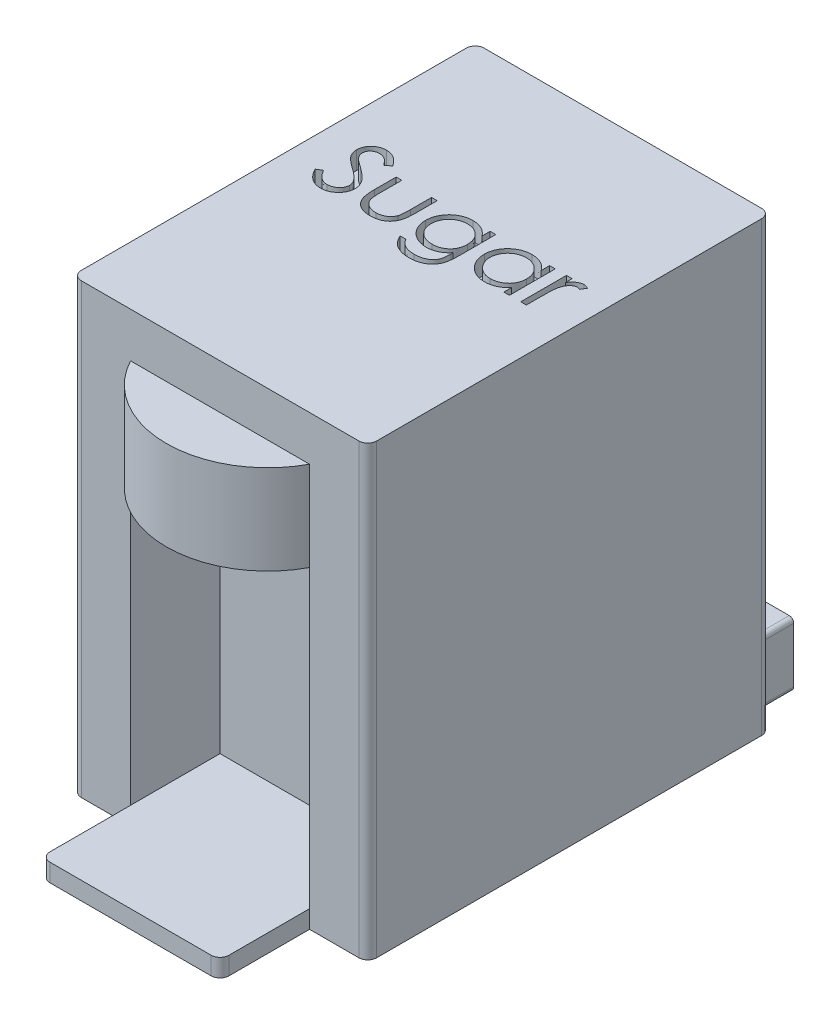
from build123d import *

# Parameters (mm, degrees)
SKETCH1_W           = 330
SKETCH1_H           = 450
BOSS_EXTRUDE1_DEPTH = 500
SKETCH2_W           = 200
SKETCH2_H           = 350
CUT_EXTRUDE1_DEPTH  = 100
BOSS_EXTRUDE2_DEPTH = 100
SKETCH4_W           = 200
SKETCH4_H           = 20
BOSS_EXTRUDE3_DEPTH = 200
SKETCH5_R           = 58.984993577
CUT_EXTRUDE2_DEPTH  = 50
FILLET1_R           = 10
SKETCH6_W           = 108.793875533
SKETCH6_H           = 71.48855694
BOSS_EXTRUDE4_DEPTH = 50
FILLET2_R           = 5
FILLET3_R           = 10
CUT_EXTRUDE3_DEPTH  = 20


with BuildPart() as part:
    # Sketch1 → Boss-Extrude1 (new body)
    with BuildSketch(Plane(origin=(0, 0, 0), x_dir=(1, 0, 0), z_dir=(0, 1, 0))):
        Rectangle(SKETCH1_W, SKETCH1_H)
    extrude(amount=BOSS_EXTRUDE1_DEPTH)

    # Sketch2 → Cut-Extrude1 (cut)
    with BuildSketch(Plane.XY.offset(225)):
        with Locations((0, 175)):
            Rectangle(SKETCH2_W, SKETCH2_H)
    extrude(amount=-CUT_EXTRUDE1_DEPTH, mode=Mode.SUBTRACT)

    # Sketch3 → Boss-Extrude2 (add)
    with BuildSketch(Plane.XZ.offset(-350)):
        with BuildLine():
            Line((100, 225), (-100, 225))
            ThreePointArc((-100, 225), (0, 284.9775435), (100, 225))
        make_face()
    extrude(amount=-BOSS_EXTRUDE2_DEPTH)

    # Sketch4 → Boss-Extrude3 (add)
    with BuildSketch(Plane.XY.offset(125)):
        with Locations((0, 10)):
            Rectangle(SKETCH4_W, SKETCH4_H)
    extrude(amount=BOSS_EXTRUDE3_DEPTH)

    # Sketch5 → Cut-Extrude2 (cut)
    with BuildSketch(Plane.XZ.offset(-350)):
        with Locations((0, 203.171289973)):
            Circle(SKETCH5_R)
    extrude(amount=-CUT_EXTRUDE2_DEPTH, mode=Mode.SUBTRACT)

    # Fillet1
    fillet1_edges = [part.edges().sort_by_distance(p)[0] for p in [
        (165, 250, 225),
        (-165, 250, 225),
        (-165, 250, -225),
        (165, 250, -225),
    ]]
    fillet(fillet1_edges, radius=FILLET1_R)

    # Sketch6 → Boss-Extrude4 (add)
    with BuildSketch(Plane(origin=(0, 0, -225), x_dir=(-1, 0, 0), z_dir=(0, 0, -1))):
        with Locations((-86.447180312, 35.74427847)):
            Rectangle(SKETCH6_W, SKETCH6_H)
    extrude(amount=BOSS_EXTRUDE4_DEPTH)

    # Fillet2
    fillet2_edges = [part.edges().sort_by_distance(p)[0] for p in [
        (140.844118078, 71.48855694, -250),
        (140.844118078, 0, -250),
        (32.050242545, 0, -250),
        (32.050242545, 71.48855694, -250),
    ]]
    fillet(fillet2_edges, radius=FILLET2_R)

    # Fillet3
    fillet3_edges = [part.edges().sort_by_distance(p)[0] for p in [
        (-100, 10, 325),
        (100, 10, 325),
    ]]
    fillet(fillet3_edges, radius=FILLET3_R)

    # Sketch7 → Cut-Extrude3 (cut)
    # profile 1 of 5: a face of its own
    with BuildSketch(Plane(origin=(0, 500, 0), x_dir=(1, 0, 0), z_dir=(0, 1, 0))):
        with BuildLine():
            Line((-132.371794872, 13.503605769), (-126.454326923, 17.051282051))
            add(Edge.make_bspline(
                [(-126.454326923, 17.051282051), (-125.903962178, 16.129994352), (-124.849484566, 14.364842674), (-123.090457382, 11.979681866), (-121.267799159, 9.95243873), (-119.368012488, 8.29490658), (-117.402693526, 6.989928845), (-115.359012451, 6.06588421), (-113.243856237, 5.489564703), (-111.804379807, 5.419562972), (-111.085737179, 5.384615385)],
                knots=[0, 0, 0, 0, 1.272034388, 2.437168799, 3.508375237, 4.49857839, 5.41946034, 6.295179144, 7.148887113, 8, 8, 8, 8], degree=3))
            add(Edge.make_bspline(
                [(-111.085737179, 5.384615385), (-110.471999969, 5.401708835), (-109.255264508, 5.43559664), (-107.464019649, 5.761212681), (-105.724383604, 6.261455259), (-104.072210849, 6.97787389), (-102.530298559, 7.844643604), (-101.178164652, 8.891567154), (-100.009242388, 10.063691268), (-99.053060097, 11.371344361), (-98.319459391, 12.777687333), (-97.755618023, 14.22120636), (-97.44271655, 15.724577726), (-97.395581481, 16.736786983), (-97.371794872, 17.247596154)],
                knots=[0, 0, 0, 0, 1.095163259, 2.171163733, 3.241058638, 4.321873601, 5.38011039, 6.391990106, 7.366004449, 8.327778327, 9.272591725, 10.192022065, 11.087607919, 12, 12, 12, 12], degree=3))
            add(Edge.make_bspline(
                [(-97.371794872, 17.247596154), (-97.401281086, 17.830413148), (-97.46122225, 19.015194931), (-97.967851851, 20.76318799), (-98.764836788, 22.493039391), (-99.500089662, 23.563064702), (-99.881810897, 24.118589744)],
                knots=[0, 0, 0, 0, 0.938893495, 1.908633276, 2.914225137, 4, 4, 4, 4], degree=3))
            add(Edge.make_bspline(
                [(-99.881810897, 24.118589744), (-100.195223181, 24.519526216), (-100.853193067, 25.361242187), (-101.984343319, 26.614146897), (-103.311665605, 27.906515276), (-104.789736703, 29.287696415), (-106.47239848, 30.693452348), (-108.306948768, 32.190817907), (-110.340225947, 33.722849448), (-111.76621588, 34.750300759), (-112.502003205, 35.280448718)],
                knots=[0, 0, 0, 0, 0.722233717, 1.516239348, 2.393582979, 3.351407094, 4.387010283, 5.505090956, 6.712668013, 8, 8, 8, 8], degree=3))
            add(Edge.make_bspline(
                [(-112.502003205, 35.280448718), (-113.238483129, 35.80502047), (-114.64657666, 36.807961715), (-116.615748307, 38.296447396), (-118.376637567, 39.657324786), (-119.921417898, 40.903405028), (-121.249409835, 42.034857123), (-122.371078055, 43.040815906), (-123.257849197, 43.948487123), (-123.75096081, 44.537313958), (-123.972355769, 44.801682692)],
                knots=[0, 0, 0, 0, 1.452282411, 2.77665338, 3.964542531, 5.026858415, 5.96415736, 6.766646006, 7.446254459, 8, 8, 8, 8], degree=3))
            add(Edge.make_bspline(
                [(-123.972355769, 44.801682692), (-124.281806674, 45.213703429), (-124.890383408, 46.023997505), (-125.693703517, 47.29049466), (-126.376486773, 48.586959968), (-126.911733416, 49.91687726), (-127.362457793, 51.261575837), (-127.665616407, 52.638600751), (-127.855444346, 54.041773121), (-127.874884076, 54.986043133), (-127.884615385, 55.458733974)],
                knots=[0, 0, 0, 0, 1.068054152, 2.10047183, 3.106115577, 4.101338837, 5.06977816, 6.043150881, 7.020423561, 8, 8, 8, 8], degree=3))
            add(Edge.make_bspline(
                [(-127.884615385, 55.458733974), (-127.858511205, 56.199329466), (-127.806860804, 57.66469074), (-127.370050458, 59.805307349), (-126.680592585, 61.849035694), (-125.714694828, 63.775642368), (-124.469547769, 65.534961986), (-123.028628282, 67.147231725), (-121.312398557, 68.50260337), (-119.429346092, 69.686844538), (-117.36821865, 70.613763042), (-115.208400582, 71.312982645), (-112.946459142, 71.709167799), (-111.41439645, 71.766023097), (-110.637019231, 71.794871795)],
                knots=[0, 0, 0, 0, 1.005424448, 1.989358655, 2.955360095, 3.929531133, 4.905563448, 5.876582895, 6.856512386, 7.866279853, 8.892233794, 9.918561126, 10.94386622, 12, 12, 12, 12], degree=3))
            add(Edge.make_bspline(
                [(-110.637019231, 71.794871795), (-109.812137225, 71.766420763), (-108.17171019, 71.709840741), (-105.758725878, 71.217890115), (-103.43551155, 70.403876679), (-101.566646254, 69.480103519), (-100.103991025, 68.557475205), (-98.988536371, 67.717078719), (-97.858187355, 66.749576547), (-96.703826259, 65.652391626), (-95.54501307, 64.415456604), (-94.364544025, 63.047242826), (-93.159658649, 61.556111708), (-92.384541446, 60.491621693), (-91.987179487, 59.945913462)],
                knots=[0, 0, 0, 0, 1.286793592, 2.559021753, 3.825965368, 5.121522368, 5.803751409, 6.523245864, 7.299691795, 8.125521123, 9.008227632, 9.944561021, 10.946284179, 12, 12, 12, 12], degree=3))
            Line((-91.987179487, 59.945913462), (-97.666266026, 55.641025641))
            add(Edge.make_bspline(
                [(-97.666266026, 55.641025641), (-98.009184675, 56.082799449), (-98.669565817, 56.933552514), (-99.672155554, 58.124978826), (-100.617128512, 59.213308417), (-101.548136508, 60.158610977), (-102.416009137, 61.012653644), (-103.258349982, 61.743848781), (-104.063037007, 62.359360689), (-105.07737522, 63.016231888), (-106.351729586, 63.667361959), (-107.951420311, 64.218343521), (-109.623145812, 64.549444759), (-110.761738442, 64.593222511), (-111.338141026, 64.615384615)],
                knots=[0, 0, 0, 0, 1.181633172, 2.275549214, 3.290209073, 4.226197932, 5.078386478, 5.862611352, 6.581680152, 7.217281963, 8.414376989, 9.595101626, 10.782541182, 12, 12, 12, 12], degree=3))
            add(Edge.make_bspline(
                [(-111.338141026, 64.615384615), (-112.061271474, 64.591150616), (-113.455760422, 64.544417632), (-115.435565144, 64.034017926), (-117.217443645, 63.23038072), (-118.748494947, 62.104081158), (-120.023234487, 60.769661305), (-120.945343663, 59.234084203), (-121.500346954, 57.538436151), (-121.568072547, 56.355603024), (-121.602564103, 55.753205128)],
                knots=[0, 0, 0, 0, 1.14458467, 2.207223713, 3.21896685, 4.227309161, 5.202851033, 6.127160689, 7.046193047, 8, 8, 8, 8], degree=3))
            add(Edge.make_bspline(
                [(-121.602564103, 55.753205128), (-121.59470157, 55.378175557), (-121.578963648, 54.627503169), (-121.359467694, 53.51847473), (-121.077481115, 52.412247941), (-120.63062848, 51.313796285), (-120.013722407, 50.203909103), (-119.203618889, 49.063474352), (-118.183352648, 47.882440179), (-117.401812401, 47.114292703), (-116.989182692, 46.708733974)],
                knots=[0, 0, 0, 0, 0.858281714, 1.717966888, 2.583508476, 3.4729293, 4.427298488, 5.488583878, 6.674047936, 8, 8, 8, 8], degree=3))
            add(Edge.make_bspline(
                [(-116.989182692, 46.708733974), (-116.835955244, 46.571993458), (-116.471921901, 46.247129291), (-115.806403387, 45.715283679), (-114.927547422, 45.059228233), (-113.858303398, 44.247481903), (-112.578956164, 43.305852661), (-111.089365041, 42.246380418), (-109.406134384, 41.034671237), (-108.211696066, 40.187520425), (-107.580128205, 39.739583333)],
                knots=[0, 0, 0, 0, 0.420754252, 0.999615792, 1.744751191, 2.668019286, 3.750313428, 4.999500688, 6.413464383, 8, 8, 8, 8], degree=3))
            add(Edge.make_bspline(
                [(-107.580128205, 39.739583333), (-106.820409939, 39.186756142), (-105.349320811, 38.116282907), (-103.256169213, 36.507969307), (-101.358293051, 34.935013935), (-99.64902898, 33.407461793), (-98.111490811, 31.936899933), (-96.762736398, 30.505636327), (-95.589022791, 29.123924873), (-94.325438421, 27.352473359), (-93.034282031, 25.176851674), (-91.925451883, 22.511286903), (-91.226284933, 19.835360493), (-91.134854625, 18.036823763), (-91.08974359, 17.149439103)],
                knots=[0, 0, 0, 0, 1.163667725, 2.253281268, 3.268753668, 4.215851969, 5.092017293, 5.902905408, 6.650798638, 7.335211899, 8.59617414, 9.77448103, 10.901945474, 12, 12, 12, 12], degree=3))
            add(Edge.make_bspline(
                [(-91.08974359, 17.149439103), (-91.102886352, 16.521871801), (-91.128916654, 15.27892413), (-91.428134929, 13.453822592), (-91.866528232, 11.681205198), (-92.527272911, 9.98298295), (-93.333736077, 8.328087696), (-94.357061034, 6.759929688), (-95.543214729, 5.243801716), (-96.903890027, 3.820131889), (-98.392808073, 2.513207969), (-99.966481966, 1.35062674), (-101.627487425, 0.381260272), (-103.366813759, -0.409756569), (-105.184860493, -1.02842692), (-107.08101617, -1.476684302), (-109.058406394, -1.751798521), (-110.402416025, -1.78035375), (-111.085737179, -1.794871795)],
                knots=[0, 0, 0, 0, 0.983748083, 1.948392443, 2.894712957, 3.844097841, 4.80183111, 5.778335162, 6.776009319, 7.81870978, 8.863265674, 9.881300176, 10.883814829, 11.87499822, 12.874611388, 13.892143829, 14.928324115, 16, 16, 16, 16], degree=3))
            add(Edge.make_bspline(
                [(-111.085737179, -1.794871795), (-111.614444039, -1.784648163), (-112.66519924, -1.764329655), (-114.219388878, -1.584704047), (-115.742180662, -1.330561975), (-117.214466302, -0.927080575), (-118.655214535, -0.437541034), (-120.058159226, 0.165225617), (-121.423980303, 0.887569646), (-122.76033196, 1.713470139), (-124.063815452, 2.67462503), (-125.32220481, 3.794094959), (-126.576788521, 5.041005059), (-127.790536447, 6.449216326), (-128.987999333, 7.995977983), (-130.145567524, 9.695761651), (-131.287201878, 11.539308726), (-132.003511234, 12.836610441), (-132.371794872, 13.503605769)],
                knots=[0, 0, 0, 0, 0.915332311, 1.819136955, 2.706846663, 3.586547465, 4.459518054, 5.340707479, 6.227863349, 7.133153174, 8.059268498, 9.028702269, 10.047606654, 11.120612155, 12.245963614, 13.433783089, 14.680604001, 16, 16, 16, 16], degree=3))
        make_face()
    # profile 2 of 5: a face of its own
    with BuildSketch(Plane(origin=(0, 500, 0), x_dir=(1, 0, 0), z_dir=(0, 1, 0))):
        with BuildLine():
            Line((-79.423076923, 51.153846154), (-73.141025641, 51.153846154))
            Line((-73.141025641, 51.153846154), (-73.141025641, 27.427884615))
            add(Edge.make_bspline(
                [(-73.141025641, 27.427884615), (-73.138187543, 26.731429632), (-73.132758394, 25.399143871), (-73.095939576, 23.482040136), (-73.009337703, 21.733705883), (-72.901061213, 20.153131148), (-72.761818491, 18.740583316), (-72.596151281, 17.500996175), (-72.410982848, 16.420312494), (-72.229728569, 15.76944538), (-72.145432692, 15.466746795)],
                knots=[0, 0, 0, 0, 1.388932606, 2.656963016, 3.823490214, 4.879454478, 5.816252168, 6.653371382, 7.373723809, 8, 8, 8, 8], degree=3))
            add(Edge.make_bspline(
                [(-72.145432692, 15.466746795), (-72.010203592, 15.086289375), (-71.742556772, 14.333284154), (-71.257087097, 13.24550405), (-70.656520365, 12.237998401), (-69.999323808, 11.271916947), (-69.241335655, 10.375877209), (-68.392146233, 9.551392336), (-67.480181493, 8.767310511), (-66.125081025, 7.839614672), (-64.271895706, 6.845308069), (-61.838840599, 5.987391701), (-59.200756081, 5.474675301), (-57.377461695, 5.415190201), (-56.440304487, 5.384615385)],
                knots=[0, 0, 0, 0, 0.725840625, 1.436591201, 2.137033971, 2.831655856, 3.53531722, 4.242432219, 4.957935707, 5.694543706, 7.190802206, 8.724350549, 10.316345118, 12, 12, 12, 12], degree=3))
            add(Edge.make_bspline(
                [(-56.440304487, 5.384615385), (-55.503234333, 5.415840357), (-53.690176967, 5.4762549), (-51.081077581, 5.971925672), (-48.696049293, 6.800039452), (-46.559030267, 7.956187688), (-44.679713463, 9.371028945), (-43.113625088, 11.031205119), (-41.821479997, 12.884192857), (-41.257291584, 14.266678433), (-40.973557692, 14.961939103)],
                knots=[0, 0, 0, 0, 1.157059328, 2.238695713, 3.266970494, 4.264342957, 5.228770407, 6.160125903, 7.074715775, 8, 8, 8, 8], degree=3))
            add(Edge.make_bspline(
                [(-40.973557692, 14.961939103), (-40.889673091, 15.241265076), (-40.704224724, 15.858786584), (-40.504977694, 16.906381552), (-40.325488462, 18.155673643), (-40.172224939, 19.614837816), (-40.062921687, 21.280060865), (-40.004001155, 23.150822388), (-39.937435651, 25.221249592), (-39.936425325, 26.670604778), (-39.935897436, 27.427884615)],
                knots=[0, 0, 0, 0, 0.557542046, 1.232589297, 2.036731608, 2.971723315, 4.038036528, 5.22795436, 6.551621927, 8, 8, 8, 8], degree=3))
            Line((-39.935897436, 27.427884615), (-39.935897436, 51.153846154))
            Line((-39.935897436, 51.153846154), (-33.653846154, 51.153846154))
            Line((-33.653846154, 51.153846154), (-33.653846154, 26.25))
            add(Edge.make_bspline(
                [(-33.653846154, 26.25), (-33.66268005, 25.403856571), (-33.679819018, 23.762222574), (-33.789965887, 21.376540343), (-33.97895814, 19.153295446), (-34.26581184, 17.091311048), (-34.603125332, 15.192161414), (-35.038250791, 13.453412494), (-35.557815546, 11.880421415), (-36.143925846, 10.445585877), (-36.836363196, 9.144647993), (-37.572903607, 7.909931661), (-38.423399044, 6.772072957), (-39.318803729, 5.674430213), (-40.314836846, 4.671599665), (-41.392834025, 3.740570148), (-42.537622422, 2.867109513), (-43.774606382, 2.085283925), (-45.085727641, 1.380951018), (-46.472604781, 0.756629456), (-47.952224745, 0.262577915), (-49.505497485, -0.1636354), (-51.140033071, -0.497924783), (-52.854255733, -0.733656118), (-54.647588058, -0.878162736), (-55.869777252, -0.890903633), (-56.496394231, -0.897435897)],
                knots=[0, 0, 0, 0, 1.493040784, 2.896703357, 4.213163133, 5.428574705, 6.569057535, 7.615249723, 8.588095153, 9.490268104, 10.346124644, 11.18633936, 12.024365274, 12.850166724, 13.684164916, 14.514361689, 15.362232829, 16.222528818, 17.093394965, 17.986930858, 18.902426812, 19.842810585, 20.827885679, 21.843828298, 22.894529745, 24, 24, 24, 24], degree=3))
            add(Edge.make_bspline(
                [(-56.496394231, -0.897435897), (-57.118324513, -0.890641755), (-58.340475414, -0.877290631), (-60.133900299, -0.734454477), (-61.852872425, -0.498291064), (-63.491280396, -0.161186717), (-65.050768342, 0.259594682), (-66.537653139, 0.759665392), (-67.934524399, 1.381275027), (-69.258164479, 2.080826176), (-70.498212244, 2.872131684), (-71.660383805, 3.739492477), (-72.743120856, 4.681613738), (-73.746662216, 5.694560881), (-74.656921748, 6.790899608), (-75.485242582, 7.961810814), (-76.244376685, 9.195692586), (-76.931432492, 10.516955835), (-77.521667603, 11.968396031), (-78.042772521, 13.574337972), (-78.468985289, 15.352388309), (-78.815834656, 17.301026878), (-79.094863468, 19.41092771), (-79.288586312, 21.694296016), (-79.396902927, 24.145569859), (-79.414164156, 25.838567659), (-79.423076923, 26.712740385)],
                knots=[0, 0, 0, 0, 1.083640291, 2.129454052, 3.13281866, 4.105697902, 5.042300162, 5.946461698, 6.836384745, 7.703652036, 8.553297018, 9.397182691, 10.228592656, 11.052265423, 11.879314572, 12.708807002, 13.549817954, 14.402308542, 15.300838682, 16.27712199, 17.341985831, 18.484375296, 19.725102775, 21.0496083, 22.476576903, 24, 24, 24, 24], degree=3))
            Line((-79.423076923, 26.712740385), (-79.423076923, 51.153846154))
        make_face()
    # profile 3 of 5: a face of its own
    with BuildSketch(Plane(origin=(0, 500, 0), x_dir=(1, 0, 0), z_dir=(0, 1, 0))):
        with BuildLine():
            Line((25.576923077, 51.153846154), (31.858974359, 51.153846154))
            Line((31.858974359, 51.153846154), (31.858974359, 10.558894231))
            add(Edge.make_bspline(
                [(31.858974359, 10.558894231), (31.853433508, 9.694142339), (31.84273833, 8.024962885), (31.765718905, 5.611397292), (31.60330536, 3.382075582), (31.419131733, 1.32683041), (31.154197407, -0.544811791), (30.830670062, -2.238435885), (30.465956479, -3.755667132), (30.14555213, -4.690163953), (29.993990385, -5.132211538)],
                knots=[0, 0, 0, 0, 1.307562039, 2.523909702, 3.650326591, 4.686913197, 5.643429486, 6.506965704, 7.293745905, 8, 8, 8, 8], degree=3))
            add(Edge.make_bspline(
                [(29.993990385, -5.132211538), (29.77020561, -5.70680997), (29.329327081, -6.838826711), (28.503614412, -8.443513127), (27.578936339, -9.954440924), (26.522801327, -11.36318995), (25.339985246, -12.662688197), (24.058355403, -13.881168183), (22.652951575, -14.99285153), (21.12457733, -15.97855748), (19.508464666, -16.866298563), (17.805542625, -17.635229906), (16.025413858, -18.304966779), (14.151356026, -18.806622693), (12.212751337, -19.241317105), (10.186802715, -19.524210821), (8.085346779, -19.716751983), (6.656439177, -19.734556643), (5.931490385, -19.743589744)],
                knots=[0, 0, 0, 0, 0.981931301, 1.934503488, 2.87077864, 3.801706999, 4.735015492, 5.667491629, 6.616593066, 7.585388521, 8.561939025, 9.551802639, 10.560317337, 11.588439944, 12.640189604, 13.723962949, 14.845264515, 16, 16, 16, 16], degree=3))
            add(Edge.make_bspline(
                [(5.931490385, -19.743589744), (4.873795693, -19.726460027), (2.807833788, -19.693001089), (-0.204266066, -19.303182788), (-3.064960464, -18.752095326), (-5.736449598, -17.917986773), (-8.201851536, -16.897246979), (-10.444329046, -15.72534792), (-12.443751197, -14.381561744), (-14.246224657, -12.851549725), (-15.873056459, -11.032276093), (-17.403602259, -8.88829921), (-18.876821096, -6.386961427), (-19.740193854, -4.551107163), (-20.192307692, -3.58974359)],
                knots=[0, 0, 0, 0, 1.157897085, 2.2616841, 3.32207898, 4.345638746, 5.321241055, 6.241986252, 7.112515963, 7.955008012, 8.825025602, 9.77857164, 10.836726669, 12, 12, 12, 12], degree=3))
            Line((-20.192307692, -3.58974359), (-13.91025641, -3.58974359))
            add(Edge.make_bspline(
                [(-13.91025641, -3.58974359), (-13.405012224, -4.391861105), (-12.417322056, -5.959902075), (-10.570352437, -7.990165194), (-8.54622591, -9.725232488), (-6.276632246, -11.123447969), (-3.752127938, -12.177643797), (-0.971194215, -12.929149726), (2.08879822, -13.379075063), (4.219162504, -13.433300946), (5.328525641, -13.461538462)],
                knots=[0, 0, 0, 0, 0.997731894, 1.950442991, 2.880492273, 3.800895997, 4.748200782, 5.754801363, 6.83083817, 8, 8, 8, 8], degree=3))
            add(Edge.make_bspline(
                [(5.328525641, -13.461538462), (6.423863448, -13.432935486), (8.535565101, -13.377791811), (11.572188482, -12.928948928), (14.344087243, -12.177480252), (16.835291256, -11.125312528), (19.016406627, -9.836304397), (20.896646452, -8.396302909), (22.419539975, -6.772682848), (23.443799308, -5.277046727), (24.08049166, -3.944564133), (24.485936396, -2.797512213), (24.815415785, -1.50045466), (25.091012536, -0.057739936), (25.318430803, 1.532693206), (25.46248845, 3.274481273), (25.566604681, 5.16366572), (25.573404078, 6.473528484), (25.576923077, 7.151442308)],
                knots=[0, 0, 0, 0, 1.570740765, 3.028230971, 4.391408896, 5.680370741, 6.894727393, 8.017376726, 9.065722033, 10.075533815, 10.603371122, 11.180248986, 11.817768598, 12.521299649, 13.286540596, 14.121245857, 15.027658897, 16, 16, 16, 16], degree=3))
            Line((25.576923077, 7.151442308), (25.576923077, 9.801682692))
            add(Edge.make_bspline(
                [(25.576923077, 9.801682692), (24.939300729, 9.042846649), (23.675271614, 7.538522256), (21.492325072, 5.567289522), (19.107986759, 3.869566916), (16.526315911, 2.477194226), (13.810551068, 1.363565734), (10.99010646, 0.584706516), (8.090265356, 0.081508518), (6.125222359, 0.027362193), (5.132211538, 0)],
                knots=[0, 0, 0, 0, 1.012485704, 2.007162095, 2.997754123, 3.998611389, 4.999708251, 5.992315798, 6.98544096, 8, 8, 8, 8], degree=3))
            add(Edge.make_bspline(
                [(5.132211538, 0), (4.54748615, 0.010300529), (3.384954999, 0.030779692), (1.657860054, 0.209955241), (-0.043748712, 0.469930086), (-1.715902785, 0.851558866), (-3.361015046, 1.341393397), (-4.976366889, 1.953728172), (-6.57503742, 2.646030537), (-8.127967377, 3.461486606), (-9.619689992, 4.368732743), (-11.038953695, 5.351510557), (-12.378324476, 6.404676322), (-13.625054265, 7.538615118), (-14.777507694, 8.751685773), (-15.851185055, 10.030956834), (-16.828331997, 11.394291661), (-17.728999782, 12.816830812), (-18.510150789, 14.308049288), (-19.195838226, 15.835611196), (-19.792026326, 17.396250286), (-20.267334361, 18.995191539), (-20.630356626, 20.631426916), (-20.900561166, 22.302275894), (-21.053819799, 24.012883647), (-21.07771828, 25.16531063), (-21.08974359, 25.745192308)],
                knots=[0, 0, 0, 0, 1.028754217, 2.045334182, 3.052854819, 4.056607503, 5.061168794, 6.071104265, 7.095078842, 8.125279047, 9.155117945, 10.165957491, 11.161587969, 12.151493252, 13.128948131, 14.104219989, 15.088194871, 16.07871515, 17.064853787, 18.047899887, 19.02414258, 20.002704429, 20.980574569, 21.971845993, 22.979467364, 24, 24, 24, 24], degree=3))
            add(Edge.make_bspline(
                [(-21.08974359, 25.745192308), (-21.079360264, 26.325254228), (-21.058633829, 27.483131404), (-20.879614242, 29.200719111), (-20.624250454, 30.895307816), (-20.220095074, 32.54943065), (-19.733644624, 34.181925685), (-19.131173173, 35.780734814), (-18.406797986, 37.346344996), (-17.586602992, 38.879915625), (-16.664921139, 40.360867923), (-15.654271523, 41.767400841), (-14.553434038, 43.08916428), (-13.377595726, 44.339492717), (-12.112399385, 45.506322582), (-10.758499538, 46.586821879), (-9.329241933, 47.599102405), (-7.820196933, 48.521329148), (-6.254649163, 49.336974078), (-4.672372807, 50.081226017), (-3.052408106, 50.671908407), (-1.424957318, 51.192370388), (0.238640977, 51.561074293), (1.91798885, 51.845519131), (3.618835605, 52.018813551), (4.757893506, 52.040445251), (5.328525641, 52.051282051)],
                knots=[0, 0, 0, 0, 1.008818848, 2.013730394, 3.001654427, 3.987803273, 4.973046549, 5.963777569, 6.957074694, 7.972068341, 8.987420212, 9.989399531, 10.982630087, 11.977756091, 12.973280677, 13.973972381, 14.989194003, 16.018387222, 17.047741039, 18.059210846, 19.057554164, 20.045176975, 21.029480261, 22.018708529, 23.007435371, 24, 24, 24, 24], degree=3))
            add(Edge.make_bspline(
                [(5.328525641, 52.051282051), (6.269544421, 52.024148586), (8.127767367, 51.970568328), (10.862387416, 51.550145421), (13.501232215, 50.879865153), (16.059192529, 49.919552543), (18.557105549, 48.608551777), (20.986738655, 46.881692816), (23.355121338, 44.723486022), (24.816677949, 43.068428734), (25.576923077, 42.207532051)],
                knots=[0, 0, 0, 0, 0.96728863, 1.910097829, 2.838038873, 3.762875196, 4.71315279, 5.730631239, 6.819562287, 8, 8, 8, 8], degree=3))
            Line((25.576923077, 42.207532051), (25.576923077, 51.153846154))
        make_face()
        with BuildLine():
            add(Edge.make_bspline(
                [(5.833333333, 45.769230769), (4.914719256, 45.738009459), (3.096058168, 45.676197886), (0.430291318, 45.148503623), (-2.143247351, 44.321585622), (-4.575355915, 43.138733314), (-6.853498113, 41.696848555), (-8.874994522, 39.950042803), (-10.643092844, 37.955118865), (-12.13875161, 35.730113925), (-13.329378939, 33.329668416), (-14.172247329, 30.799453733), (-14.717247794, 28.180353877), (-14.777400835, 26.392901814), (-14.807692308, 25.492788462)],
                knots=[0, 0, 0, 0, 1.026226791, 2.031711442, 3.026614839, 4.04107745, 5.047145931, 6.032893242, 7.017642609, 8.019221815, 9.021877557, 10.003543541, 10.994637589, 12, 12, 12, 12], degree=3))
            add(Edge.make_bspline(
                [(-14.807692308, 25.492788462), (-14.793177171, 24.814123011), (-14.764630142, 23.479386531), (-14.490158587, 21.520628636), (-14.046539284, 19.655022364), (-13.417795158, 17.882454874), (-12.63874126, 16.192758977), (-11.658893841, 14.597574282), (-10.505874407, 13.09548016), (-9.188707649, 11.697586525), (-7.737180011, 10.424367156), (-6.162796025, 9.305606344), (-4.467691031, 8.390591925), (-2.693554827, 7.599775173), (-0.797339707, 7.022193814), (1.193642014, 6.581418234), (3.293475944, 6.329243083), (4.72491073, 6.297987127), (5.454727564, 6.282051282)],
                knots=[0, 0, 0, 0, 1.039728707, 2.044842319, 3.024901384, 3.974314358, 4.923051295, 5.871625912, 6.837440708, 7.820715446, 8.810779094, 9.792721783, 10.773906224, 11.758876063, 12.764959493, 13.806266761, 14.881525401, 16, 16, 16, 16], degree=3))
            add(Edge.make_bspline(
                [(5.454727564, 6.282051282), (6.194002728, 6.297403463), (7.639647477, 6.32742449), (9.751066205, 6.585494461), (11.751721013, 7.001933987), (13.63977746, 7.593194493), (15.422364281, 8.347629506), (17.079456573, 9.302361856), (18.646585535, 10.389650497), (20.073713726, 11.657890781), (21.364197037, 13.055590681), (22.488812374, 14.576488581), (23.447101355, 16.197698962), (24.240654752, 17.919039076), (24.846478835, 19.753886137), (25.252856935, 21.697653252), (25.536991839, 23.74102803), (25.563410332, 25.141200353), (25.576923077, 25.857371795)],
                knots=[0, 0, 0, 0, 1.121943988, 2.193949579, 3.223793937, 4.220241907, 5.192961521, 6.155822191, 7.11847367, 8.083710714, 9.04790392, 10.001595906, 10.949595423, 11.902125208, 12.873731292, 13.87582262, 14.913508608, 16, 16, 16, 16], degree=3))
            add(Edge.make_bspline(
                [(25.576923077, 25.857371795), (25.550131714, 26.789728874), (25.497790804, 28.611226974), (25.003847651, 31.265362334), (24.207443447, 33.760735809), (23.090508401, 36.089455327), (21.690868228, 38.226846321), (20.005051251, 40.13332321), (18.062130639, 41.811340342), (15.867688635, 43.209304212), (13.506739733, 44.338612901), (11.036315811, 45.185848343), (8.460084533, 45.665734644), (6.713956342, 45.734533509), (5.833333333, 45.769230769)],
                knots=[0, 0, 0, 0, 1.070913519, 2.092188694, 3.091357305, 4.074328408, 5.051968682, 6.018948707, 6.99050112, 7.9935919, 9.000589572, 9.992915277, 10.987769056, 12, 12, 12, 12], degree=3))
        make_face(mode=Mode.SUBTRACT)
    # profile 4 of 5: a face of its own
    with BuildSketch(Plane(origin=(0, 500, 0), x_dir=(1, 0, 0), z_dir=(0, 1, 0))):
        with BuildLine():
            Line((98.269230769, 51.153846154), (98.269230769, 0))
            Line((98.269230769, 0), (91.987179487, 0))
            Line((91.987179487, 0), (91.987179487, 8.848157051))
            add(Edge.make_bspline(
                [(91.987179487, 8.848157051), (91.278803675, 8.047365172), (89.896399369, 6.48460975), (87.58757701, 4.442966301), (85.140213452, 2.75539987), (82.566187029, 1.392401556), (79.867822162, 0.368560429), (77.051100417, -0.359162754), (74.114872799, -0.827039457), (72.109825703, -0.873759894), (71.09375, -0.897435897)],
                knots=[0, 0, 0, 0, 1.074387032, 2.096679803, 3.090159297, 4.057316773, 5.018401886, 5.985159533, 6.978961417, 8, 8, 8, 8], degree=3))
            add(Edge.make_bspline(
                [(71.09375, -0.897435897), (70.190390923, -0.872908452), (68.408926826, -0.824539244), (65.788345283, -0.449293171), (63.266500294, 0.153319261), (60.841008841, 0.991337051), (58.527565932, 2.102953484), (56.306363998, 3.433778445), (54.188910158, 5.018595047), (52.207479379, 6.830355614), (50.382839371, 8.798255357), (48.781613919, 10.897166295), (47.446552322, 13.118012373), (46.330150708, 15.43267545), (45.470223819, 17.858973841), (44.870751134, 20.3885172), (44.4959422, 23.018314671), (44.447592986, 24.809105133), (44.423076923, 25.717147436)],
                knots=[0, 0, 0, 0, 1.033919861, 2.038935746, 3.024066025, 3.998881131, 4.97069526, 5.957263378, 6.95902576, 7.993208707, 9.027059324, 10.027763471, 11.009749337, 11.988697705, 12.965288445, 13.950418724, 14.960734635, 16, 16, 16, 16], degree=3))
            add(Edge.make_bspline(
                [(44.423076923, 25.717147436), (44.448136351, 26.606421507), (44.497677487, 28.364468374), (44.866741884, 30.950042333), (45.487362057, 33.440407548), (46.358319011, 35.827546413), (47.47515811, 38.114347416), (48.83371985, 40.302427916), (50.434102344, 42.397815865), (52.279150485, 44.351240401), (54.277845888, 46.155652687), (56.416020506, 47.723833596), (58.640486133, 49.078170572), (60.985746343, 50.151240098), (63.417088439, 51.019422189), (65.956157354, 51.620081551), (68.592388928, 51.974027976), (70.382198769, 52.025283259), (71.290064103, 52.051282051)],
                knots=[0, 0, 0, 0, 1.020392517, 2.01726096, 2.990465484, 3.961182959, 4.928053699, 5.906110375, 6.912531644, 7.948652711, 8.985773172, 9.998621852, 10.987621588, 11.969261332, 12.953316658, 13.946091881, 14.958173133, 16, 16, 16, 16], degree=3))
            add(Edge.make_bspline(
                [(71.290064103, 52.051282051), (72.334061284, 52.02252702), (74.381290483, 51.966139762), (77.375850669, 51.496885216), (80.208740227, 50.704115873), (82.901827267, 49.625765912), (85.445440989, 48.192791331), (87.815500676, 46.38519211), (90.036810342, 44.214368371), (91.324416175, 42.546959481), (91.987179487, 41.688701923)],
                knots=[0, 0, 0, 0, 1.038897134, 2.037228247, 3.008116434, 3.962042015, 4.918381754, 5.904844433, 6.921570401, 8, 8, 8, 8], degree=3))
            Line((91.987179487, 41.688701923), (91.987179487, 51.153846154))
            Line((91.987179487, 51.153846154), (98.269230769, 51.153846154))
        make_face()
        with BuildLine():
            add(Edge.make_bspline(
                [(71.374198718, 45.769230769), (70.455911961, 45.736558015), (68.643359961, 45.672067194), (65.98247992, 45.16859729), (63.436211638, 44.330905403), (61.017290153, 43.18526738), (58.76392582, 41.744692647), (56.750052404, 40.002264981), (54.959198377, 38.005524698), (53.453033092, 35.76348249), (52.225223154, 33.359920669), (51.361882515, 30.847431907), (50.792497567, 28.271332356), (50.734327155, 26.52407864), (50.705128205, 25.647035256)],
                knots=[0, 0, 0, 0, 1.031046209, 2.035121221, 3.029706178, 4.034933723, 5.034054252, 6.02443088, 7.017295772, 8.038157696, 9.050218397, 10.03989886, 11.016116709, 12, 12, 12, 12], degree=3))
            add(Edge.make_bspline(
                [(50.705128205, 25.647035256), (50.742426071, 24.775233113), (50.816875609, 23.035045995), (51.351889497, 20.45543446), (52.249486965, 17.942353619), (53.47432822, 15.517133748), (55.008060714, 13.265451741), (56.785833765, 11.23064929), (58.824839392, 9.480857524), (61.083389533, 8.016106052), (63.495548941, 6.832855634), (66.032227571, 6.009542844), (68.645740334, 5.477987232), (70.422787011, 5.415897695), (71.318108974, 5.384615385)],
                knots=[0, 0, 0, 0, 0.979072187, 1.954306742, 2.945804271, 3.96968567, 4.997920485, 5.998718438, 6.996577872, 8.005894225, 9.015743152, 10.005417472, 10.995077863, 12, 12, 12, 12], degree=3))
            add(Edge.make_bspline(
                [(71.318108974, 5.384615385), (72.22703903, 5.417814663), (74.03481076, 5.483844735), (76.703584918, 5.989470041), (79.293484174, 6.824846008), (81.769228741, 7.982828543), (84.075551364, 9.417975661), (86.145508916, 11.098117481), (87.895828284, 13.052181164), (89.379680475, 15.199710225), (90.543188809, 17.553950154), (91.390709993, 20.060633969), (91.891788109, 22.719848932), (91.954942702, 24.537127471), (91.987179487, 25.46474359)],
                knots=[0, 0, 0, 0, 1.01762866, 2.023962475, 3.030623092, 4.058876274, 5.077231937, 6.066672613, 7.034107872, 8.005628644, 8.981990164, 9.965428785, 10.961468474, 12, 12, 12, 12], degree=3))
            add(Edge.make_bspline(
                [(91.987179487, 25.46474359), (91.96798636, 26.1715002), (91.930208211, 27.562620867), (91.641596821, 29.605171218), (91.182498292, 31.559845739), (90.535574892, 33.42869952), (89.685749204, 35.201399828), (88.660793886, 36.890675032), (87.442684891, 38.48773926), (86.051030969, 39.97060068), (84.527726918, 41.323129925), (82.915836106, 42.530414739), (81.196261167, 43.522190194), (79.397920428, 44.343015624), (77.517693739, 44.996198622), (75.540281343, 45.431952497), (73.486701604, 45.731158918), (72.085780496, 45.756406533), (71.374198718, 45.769230769)],
                knots=[0, 0, 0, 0, 1.050140795, 2.067009409, 3.05949893, 4.030605086, 5.00011959, 5.97591094, 6.962425594, 7.979863591, 8.993523472, 9.986985069, 10.967611495, 11.937549037, 12.921786183, 13.919465291, 14.943216303, 16, 16, 16, 16], degree=3))
        make_face(mode=Mode.SUBTRACT)
    # profile 5 of 5: a face of its own
    with BuildSketch(Plane(origin=(0, 500, 0), x_dir=(1, 0, 0), z_dir=(0, 1, 0))):
        with BuildLine():
            Line((110.833333333, 51.153846154), (117.115384615, 51.153846154))
            Line((117.115384615, 51.153846154), (117.115384615, 43.623798077))
            add(Edge.make_bspline(
                [(117.115384615, 43.623798077), (117.57915979, 44.324914643), (118.466126209, 45.665794629), (119.940384796, 47.439180649), (121.450451422, 48.907481581), (123.003555168, 50.077551957), (124.611117166, 50.953814333), (126.2378562, 51.595675034), (127.909365598, 51.975221339), (129.032604082, 52.025894518), (129.595352564, 52.051282051)],
                knots=[0, 0, 0, 0, 1.2804753, 2.448899062, 3.506932113, 4.484331642, 5.4025378, 6.288909075, 7.142734305, 8, 8, 8, 8], degree=3))
            add(Edge.make_bspline(
                [(129.595352564, 52.051282051), (130.031879094, 52.027471519), (130.930060798, 51.978479803), (132.289712594, 51.63426331), (133.690581632, 51.084702859), (134.593429377, 50.567898405), (135.064102564, 50.298477564)],
                knots=[0, 0, 0, 0, 0.901110191, 1.854092781, 2.881294221, 4, 4, 4, 4], degree=3))
            Line((135.064102564, 50.298477564), (131.614583333, 44.857772436))
            add(Edge.make_bspline(
                [(131.614583333, 44.857772436), (131.31240291, 44.992577758), (130.73880662, 45.248464066), (129.899715295, 45.551304269), (129.12608856, 45.729622586), (128.633217393, 45.756636935), (128.403445513, 45.769230769)],
                knots=[0, 0, 0, 0, 1.180555205, 2.24091978, 3.179933427, 4, 4, 4, 4], degree=3))
            add(Edge.make_bspline(
                [(128.403445513, 45.769230769), (127.899330843, 45.735630022), (126.871083043, 45.667094237), (125.361393055, 45.128318082), (123.896448945, 44.257813279), (122.733015698, 43.292391042), (121.832170641, 42.361435093), (121.18936613, 41.548467042), (120.599711191, 40.636894411), (120.036306783, 39.642300735), (119.522980899, 38.547703815), (119.043887515, 37.364039546), (118.610710256, 36.089936971), (118.363705372, 35.202286566), (118.237179487, 34.747596154)],
                knots=[0, 0, 0, 0, 1.125678352, 2.296057538, 3.5422874, 4.923748041, 5.663163013, 6.437101912, 7.23742474, 8.08941207, 8.991984279, 9.93940061, 10.944477711, 12, 12, 12, 12], degree=3))
            add(Edge.make_bspline(
                [(118.237179487, 34.747596154), (118.14253162, 34.342052682), (117.932893786, 33.443804709), (117.729063029, 31.936834215), (117.52767267, 30.15636104), (117.385740303, 28.097429182), (117.25417946, 25.765180304), (117.179977815, 23.156061391), (117.117915004, 20.267394368), (117.116253667, 18.247907304), (117.115384615, 17.19150641)],
                knots=[0, 0, 0, 0, 0.566838948, 1.255505196, 2.06880316, 3.007127437, 4.065329342, 5.249902469, 6.561414163, 8, 8, 8, 8], degree=3))
            Line((117.115384615, 17.19150641), (117.115384615, 0))
            Line((117.115384615, 0), (110.833333333, 0))
            Line((110.833333333, 0), (110.833333333, 51.153846154))
        make_face()
    extrude(amount=-CUT_EXTRUDE3_DEPTH, mode=Mode.SUBTRACT)


solid = part.part
